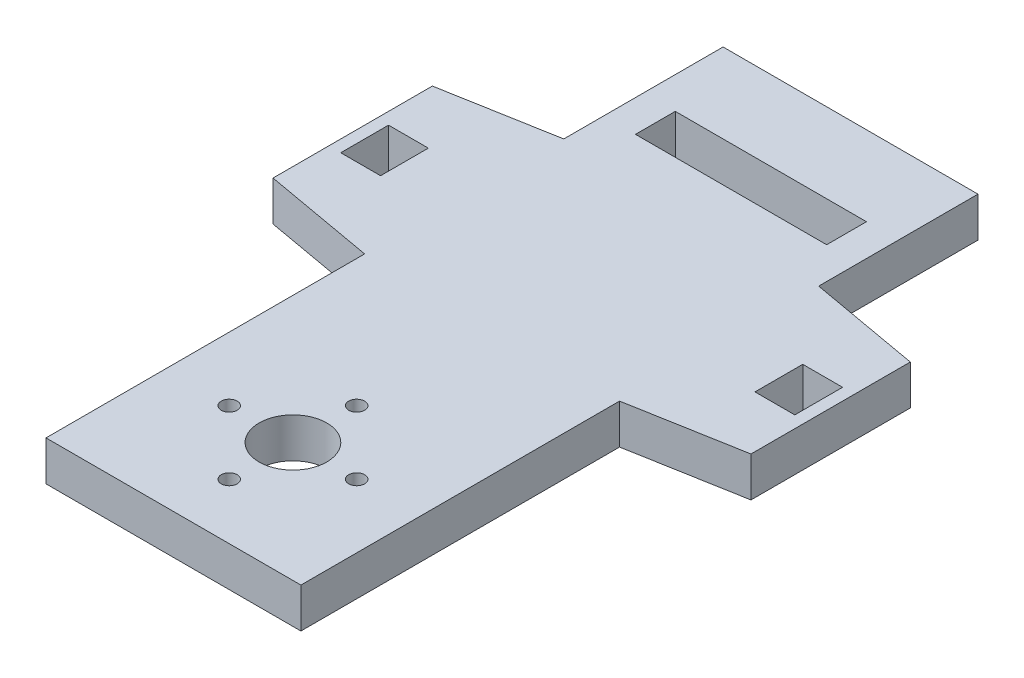
from build123d import *

# Parameters (mm, degrees)
BOSS_EXTRUDE1_DEPTH = 5
SKETCH2_R           = 4.25
SKETCH2_R_2         = 1
SKETCH2_W           = 5
SKETCH2_H           = 6
SKETCH2_W_2         = 24
SKETCH2_H_2         = 5
CUT_EXTRUDE1_DEPTH  = 5


with BuildPart() as part:
    # Sketch1 → Boss-Extrude1 (new body)
    with BuildSketch(Plane(origin=(0, 0, 0), x_dir=(1, 0, 0), z_dir=(0, 1, 0))):
        Polygon((-16, -42.5), (16, -42.5), (16, -2.5), (30, 0), (30, 20), (16, 22.5), (16, 42.5), (-16, 42.5), (-16, 22.5), (-30, 20), (-30, 0), (-16, -2.5), align=None)
    extrude(amount=BOSS_EXTRUDE1_DEPTH)

    # Sketch2 → Cut-Extrude1 (cut)
    with BuildSketch(Plane(origin=(0, 5, 0), x_dir=(1, 0, 0), z_dir=(0, 1, 0))):
        with Locations(Location((0, -27.5, 0), (0, 0, 270))):
            Circle(SKETCH2_R)
        with Locations(Location((-8, -27.5, 0), (0, 0, 270))):
            Circle(SKETCH2_R_2)
        with Locations(Location((0, -19.5, 0), (0, 0, 270))):
            Circle(SKETCH2_R_2)
        with Locations(Location((8, -27.5, 0), (0, 0, 270))):
            Circle(SKETCH2_R_2)
        with Locations(Location((0, -35.5, 0), (0, 0, 270))):
            Circle(SKETCH2_R_2)
        with Locations((-26, 10)):
            Rectangle(SKETCH2_W, SKETCH2_H)
        with Locations((26, 10)):
            Rectangle(SKETCH2_W, SKETCH2_H)
        with Locations((0, 30)):
            Rectangle(SKETCH2_W_2, SKETCH2_H_2)
    extrude(amount=-CUT_EXTRUDE1_DEPTH, mode=Mode.SUBTRACT)


solid = part.part
